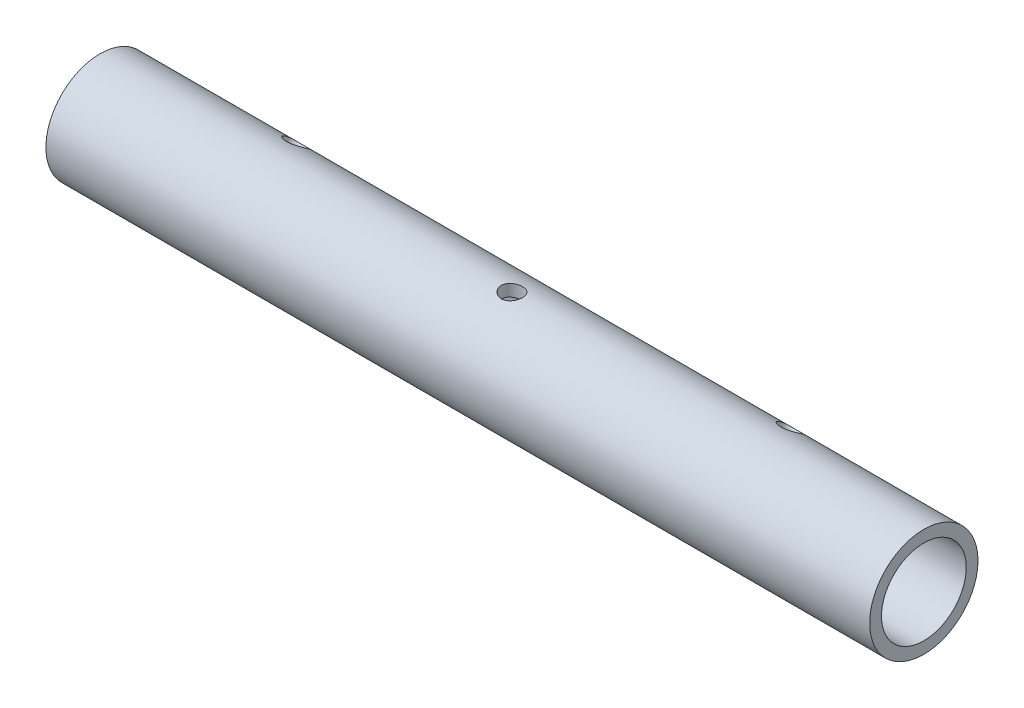
from build123d import *

# Parameters (mm, degrees)
SKETCH1_R               = 16.7005
SKETCH1_R_2             = 13.0683
BOSS_EXTRUDE1_DEPTH     = 254
CUT_EXTRUDE2_DEPTH      = 256.095694594
CUT_EXTRUDE2_DEPTH_BACK = 256.095694594
SKETCH3_R               = 3.2639
CUT_EXTRUDE3_DEPTH      = 256.095694707
CUT_EXTRUDE3_DEPTH_BACK = 256.095694707
SKETCH4_R               = 3.2639


with BuildPart() as part:
    # Sketch1 → Boss-Extrude1 (new body)
    with BuildSketch(Plane(origin=(0, 0, 0), x_dir=(0, 0, -1), z_dir=(1, 0, 0))):
        Circle(SKETCH1_R)
        Circle(SKETCH1_R_2, mode=Mode.SUBTRACT)
    extrude(amount=BOSS_EXTRUDE1_DEPTH)

    # Sketch3 → Cut-Extrude2 (cut, two sides: drawn at the far end of the back side and taken through both)
    with BuildSketch(Plane(origin=(0, 0, 0), x_dir=(1, 0, 0), z_dir=(0, 1, 0)).offset(-CUT_EXTRUDE2_DEPTH_BACK)):
        with Locations((127, 0)):
            Circle(SKETCH3_R)
    extrude(amount=CUT_EXTRUDE2_DEPTH + CUT_EXTRUDE2_DEPTH_BACK, mode=Mode.SUBTRACT)

    # Sketch4 → Cut-Extrude3 (cut, two sides: drawn at the far end of the back side and taken through both)
    with BuildSketch(Plane(origin=(0, 0, 0), x_dir=(-1, 0, 0), z_dir=(0, 0.819152044288991, -0.5735764363510473)).offset(-CUT_EXTRUDE3_DEPTH_BACK)):
        with Locations((-203.2, 0)):
            Circle(SKETCH4_R)
        with Locations((-50.8, 0)):
            Circle(SKETCH4_R)
    extrude(amount=CUT_EXTRUDE3_DEPTH + CUT_EXTRUDE3_DEPTH_BACK, mode=Mode.SUBTRACT)


solid = part.part
